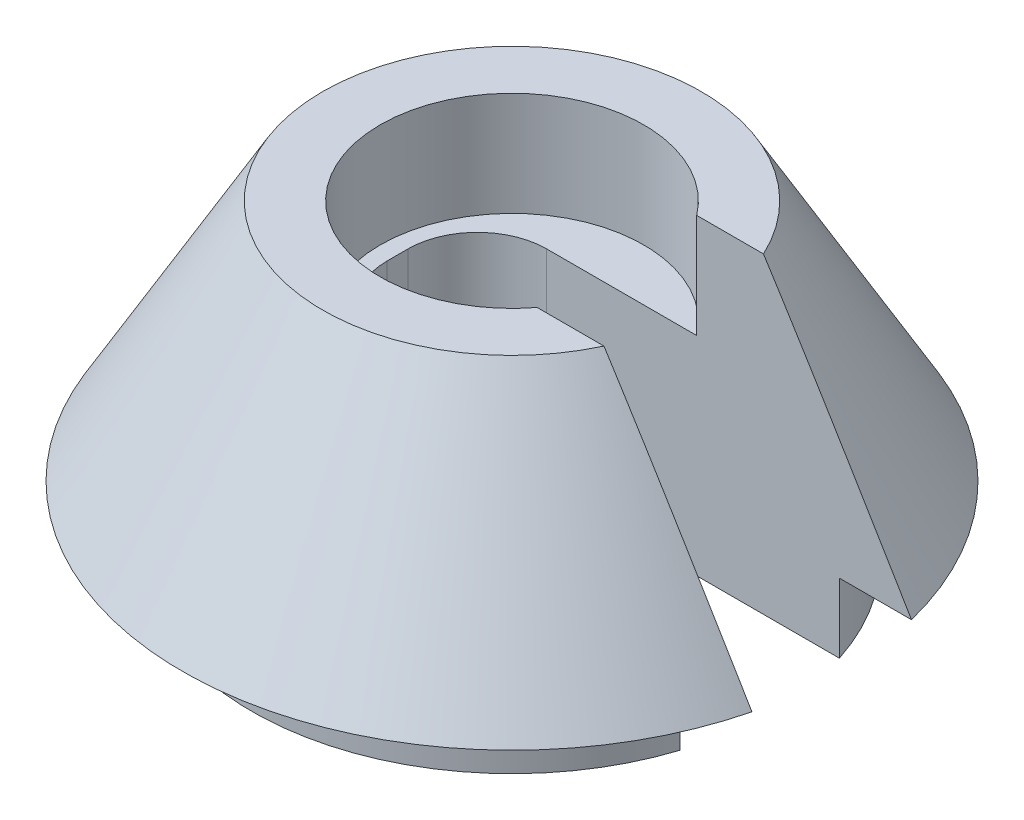
from build123d import *

# Parameters (mm, degrees)
SKETCH_1_R          = 7.5
EXTRUDE_1_DEPTH     = 2
SKETCH_2_R          = 9.5
EXTRUDE_2_DEPTH     = 7
EXTRUDE_2_TAPER     = 30
SKETCH_4_R          = 3.8
CUT_EXTRUDE_1_DEPTH = 3
CUT_EXTRUDE_2_DEPTH = 17.170961802


with BuildPart() as part:
    # 草图1 → 凸台-拉伸1 (new body)
    with BuildSketch(Plane(origin=(0, 0, 0), x_dir=(1, 0, 0), z_dir=(0, 1, 0))):
        with Locations(Location((0, 0, 0), (0, 0, 270))):
            Circle(SKETCH_1_R)
    extrude(amount=EXTRUDE_1_DEPTH)

    # 草图2 → 凸台-拉伸2 (add)
    with BuildSketch(Plane(origin=(0, 2, 0), x_dir=(1, 0, 0), z_dir=(0, 1, 0))):
        Circle(SKETCH_2_R)
    extrude(amount=EXTRUDE_2_DEPTH, taper=EXTRUDE_2_TAPER)

    # 草图4 → 切除-拉伸1 (cut)
    with BuildSketch(Plane(origin=(0, 9, 0), x_dir=(1, 0, 0), z_dir=(0, 1, 0))):
        with Locations(Location((0, 0, 0), (0, 0, 270))):
            Circle(SKETCH_4_R)
    extrude(amount=-CUT_EXTRUDE_1_DEPTH, mode=Mode.SUBTRACT)

    # 草图5 → 切除-拉伸2 (cut, through all)
    with BuildSketch(Plane(origin=(0, 0, 0), x_dir=(-1, 0, 0), z_dir=(0, -1, 0))):
        with BuildLine():
            Line((1.3, -2.3), (-11.887634873, -2.3))
            Line((-11.887634873, -2.3), (-11.887634873, 2.3))
            Line((-11.887634873, 2.3), (1.3, 2.3))
            ThreePointArc((1.3, 2.3), (2.714213562, 1.714213562), (3.3, 0.3))
            Line((3.3, 0.3), (3.3, -0.3))
            ThreePointArc((3.3, -0.3), (2.714213562, -1.714213562), (1.3, -2.3))
        make_face()
    extrude(amount=-CUT_EXTRUDE_2_DEPTH, mode=Mode.SUBTRACT)


solid = part.part
